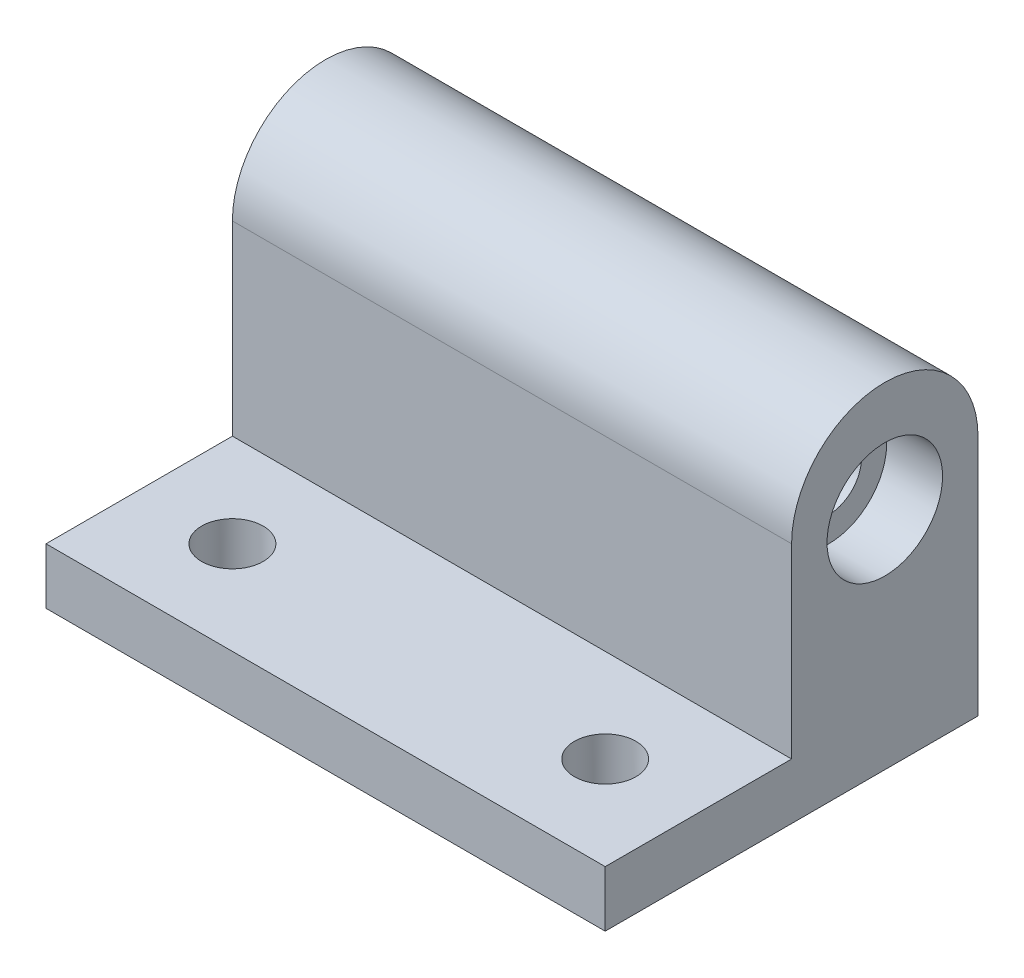
from build123d import *

# Parameters (mm, degrees)
SKETCH1_W           = 30
SKETCH1_H           = 30
BOSS_EXTRUDE1_DEPTH = 22.1
SKETCH2_R           = 3.1
CUT_EXTRUDE1_DEPTH  = 3
SKETCH3_R           = 1.75
CUT_EXTRUDE2_DEPTH  = 38.979073185
CUT_EXTRUDE3_START  = -3
SKETCH4_R           = 3.1
CUT_EXTRUDE3_DEPTH  = 3
SKETCH5_R           = 1.649559613
CUT_EXTRUDE4_DEPTH  = 31.633478418
CUT_EXTRUDE5_DEPTH  = 41.167275237


with BuildPart() as part:
    # Sketch1 → Boss-Extrude1 (new body)
    with BuildSketch(Plane(origin=(0, 0, 0), x_dir=(1, 0, 0), z_dir=(0, 1, 0))):
        Rectangle(SKETCH1_W, SKETCH1_H)
    extrude(amount=BOSS_EXTRUDE1_DEPTH)

    # Sketch2 → Cut-Extrude1 (cut)
    with BuildSketch(Plane(origin=(15, 0, 0), x_dir=(0, 0, -1), z_dir=(1, 0, 0))):
        with Locations((0, 12.1)):
            Circle(SKETCH2_R)
    extrude(amount=-CUT_EXTRUDE1_DEPTH, mode=Mode.SUBTRACT)

    # Sketch3 → Cut-Extrude2 (cut, through all)
    with BuildSketch(Plane(origin=(12, 0, 0), x_dir=(0, 0, -1), z_dir=(1, 0, 0))):
        with Locations((0, 12.1)):
            Circle(SKETCH3_R)
    extrude(amount=-CUT_EXTRUDE2_DEPTH, mode=Mode.SUBTRACT)

    # Sketch4 → Cut-Extrude3 (cut)
    with BuildSketch(Plane.ZY.offset(15).offset(CUT_EXTRUDE3_START)):
        with Locations(Location((0, 12.1, 0), (0, 0, 180))):
            Circle(SKETCH4_R)
    extrude(amount=CUT_EXTRUDE3_DEPTH, mode=Mode.SUBTRACT)

    # Sketch5 → Cut-Extrude4 (cut, through all)
    with BuildSketch(Plane(origin=(0, 22.1, 0), x_dir=(1, 0, 0), z_dir=(0, 1, 0))):
        with Locations(Location((-10, 10, 0), (0, 0, 270))):
            Circle(SKETCH5_R)
        with Locations(Location((10, 10, 0), (0, 0, 270))):
            Circle(SKETCH5_R)
        with Locations(Location((10, -10, 0), (0, 0, 270))):
            Circle(SKETCH5_R)
        with Locations(Location((-10, -10, 0), (0, 0, 270))):
            Circle(SKETCH5_R)
    extrude(amount=-CUT_EXTRUDE4_DEPTH, mode=Mode.SUBTRACT)

    # Sketch6 → Cut-Extrude5 (cut, through all)
    with BuildSketch(Plane.ZY.offset(15)):
        with BuildLine():
            Line((-5, 3), (-5, 13))
            ThreePointArc((-5, 13), (0, 18), (5, 13))
            Line((5, 13), (5, 3))
            Line((5, 3), (15, 3))
            Line((15, 3), (15, 22.1))
            Line((15, 22.1), (-15, 22.1))
            Line((-15, 22.1), (-15, 3))
            Line((-15, 3), (-15, 0))
            Line((-15, 0), (-5, 0))
            Line((-5, 0), (-5, 3))
        make_face()
    extrude(amount=-CUT_EXTRUDE5_DEPTH, mode=Mode.SUBTRACT)


solid = part.part
